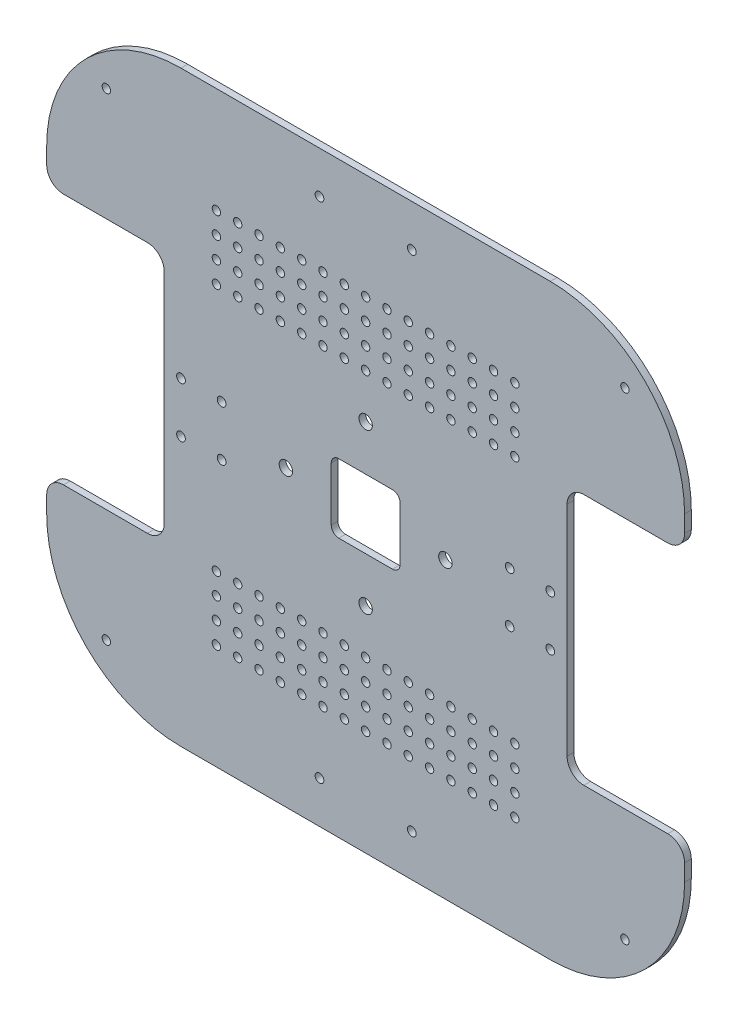
from build123d import *

# Parameters (mm, degrees)
SKETCH_1_R          = 2.6
SKETCH_1_R_2        = 2.5
SKETCH_1_R_3        = 4
SKETCH_1_W          = 41
SKETCH_1_H          = 41
EXTRUDE_1_DEPTH     = 4
FILLET_1_R          = 80
FILLET_2_R          = 10
FILLET_3_R          = 4.5
SKETCH_2_R          = 2.5
CUT_EXTRUDE_1_DEPTH = 10


with BuildPart() as part:
    # 草图1 → 凸台-拉伸1 (new body)
    with BuildSketch(Plane.XY):
        Polygon((-190, 175), (190, 175), (190, 75), (120, 75), (120, -75), (190, -75), (190, -175), (-190, -175), (-190, -75), (-120, -75), (-120, 75), (-190, 75), align=None)
        with Locations((-110, 15)):
            Circle(SKETCH_1_R, mode=Mode.SUBTRACT)
        with Locations((-85.8, 15)):
            Circle(SKETCH_1_R, mode=Mode.SUBTRACT)
        with Locations((-85.8, -15)):
            Circle(SKETCH_1_R, mode=Mode.SUBTRACT)
        with Locations((-110, -15)):
            Circle(SKETCH_1_R, mode=Mode.SUBTRACT)
        with Locations(Location((85.8, -15, 0), (0, 0, 180))):
            Circle(SKETCH_1_R, mode=Mode.SUBTRACT)
        with Locations(Location((110, -15, 0), (0, 0, 180))):
            Circle(SKETCH_1_R, mode=Mode.SUBTRACT)
        with Locations(Location((85.8, 15, 0), (0, 0, 180))):
            Circle(SKETCH_1_R, mode=Mode.SUBTRACT)
        with Locations(Location((110, 15, 0), (0, 0, 180))):
            Circle(SKETCH_1_R, mode=Mode.SUBTRACT)
        with Locations((154.464472083, 142.269908498)):
            Circle(SKETCH_1_R_2, mode=Mode.SUBTRACT)
        with Locations((47.5, 0)):
            Circle(SKETCH_1_R_3, mode=Mode.SUBTRACT)
        with Locations((0, -47.5)):
            Circle(SKETCH_1_R_3, mode=Mode.SUBTRACT)
        with Locations((-154.464472083, 142.269908498)):
            Circle(SKETCH_1_R_2, mode=Mode.SUBTRACT)
        with Locations((-154.464472083, -142.269908498)):
            Circle(SKETCH_1_R_2, mode=Mode.SUBTRACT)
        with Locations((154.464472083, -142.269908498)):
            Circle(SKETCH_1_R_2, mode=Mode.SUBTRACT)
        with Locations((-47.5, 0)):
            Circle(SKETCH_1_R_3, mode=Mode.SUBTRACT)
        with Locations((0, 47.5)):
            Circle(SKETCH_1_R_3, mode=Mode.SUBTRACT)
        with Locations((27.5, -150)):
            Circle(SKETCH_1_R, mode=Mode.SUBTRACT)
        with Locations(Location((-27.5, -150, 0), (0, 0, 180))):
            Circle(SKETCH_1_R, mode=Mode.SUBTRACT)
        with Locations((-27.5, 150)):
            Circle(SKETCH_1_R, mode=Mode.SUBTRACT)
        with Locations(Location((27.5, 150, 0), (0, 0, 180))):
            Circle(SKETCH_1_R, mode=Mode.SUBTRACT)
        Rectangle(SKETCH_1_W, SKETCH_1_H, mode=Mode.SUBTRACT)
    extrude(amount=EXTRUDE_1_DEPTH)

    # 圆角1
    fillet_1_edges = [part.edges().sort_by_distance(p)[0] for p in [
        (190, -175, 2),
        (-190, -175, 2),
        (-190, 175, 2),
        (190, 175, 2),
    ]]
    fillet(fillet_1_edges, radius=FILLET_1_R)

    # 圆角2
    fillet_2_edges = [part.edges().sort_by_distance(p)[0] for p in [
        (-190, -75, 2),
        (-120, -75, 2),
        (-120, 75, 2),
        (-190, 75, 2),
        (190, 75, 2),
        (120, 75, 2),
        (120, -75, 2),
        (190, -75, 2),
    ]]
    fillet(fillet_2_edges, radius=FILLET_2_R)

    # 圆角3
    fillet_3_edges = [part.edges().sort_by_distance(p)[0] for p in [
        (20.5, -20.5, 2),
        (20.5, 20.5, 2),
        (-20.5, 20.5, 2),
        (-20.5, -20.5, 2),
    ]]
    fillet(fillet_3_edges, radius=FILLET_3_R)

    # 草图2 → 切除-拉伸1 (cut)
    with BuildSketch(Plane.XY.offset(4)):
        with Locations((88.9, 74)):
            Circle(SKETCH_2_R)
        with Locations((76.2, 74)):
            Circle(SKETCH_2_R)
        with Locations((63.5, 74)):
            Circle(SKETCH_2_R)
        with Locations((50.8, 74)):
            Circle(SKETCH_2_R)
        with Locations((38.1, 74)):
            Circle(SKETCH_2_R)
        with Locations((25.4, 74)):
            Circle(SKETCH_2_R)
        with Locations((12.7, 74)):
            Circle(SKETCH_2_R)
        with Locations((0, 74)):
            Circle(SKETCH_2_R)
        with Locations((-12.7, 74)):
            Circle(SKETCH_2_R)
        with Locations((-25.4, 74)):
            Circle(SKETCH_2_R)
        with Locations((-38.1, 74)):
            Circle(SKETCH_2_R)
        with Locations((-50.8, 74)):
            Circle(SKETCH_2_R)
        with Locations((-63.5, 74)):
            Circle(SKETCH_2_R)
        with Locations((-76.2, 74)):
            Circle(SKETCH_2_R)
        with Locations((-88.9, 74)):
            Circle(SKETCH_2_R)
        with Locations((76.2, 86.7)):
            Circle(SKETCH_2_R)
        with Locations((63.5, 86.7)):
            Circle(SKETCH_2_R)
        with Locations((50.8, 86.7)):
            Circle(SKETCH_2_R)
        with Locations((38.1, 86.7)):
            Circle(SKETCH_2_R)
        with Locations((25.4, 86.7)):
            Circle(SKETCH_2_R)
        with Locations((12.7, 86.7)):
            Circle(SKETCH_2_R)
        with Locations((0, 86.7)):
            Circle(SKETCH_2_R)
        with Locations((-12.7, 86.7)):
            Circle(SKETCH_2_R)
        with Locations((-25.4, 86.7)):
            Circle(SKETCH_2_R)
        with Locations((-38.1, 86.7)):
            Circle(SKETCH_2_R)
        with Locations((-50.8, 86.7)):
            Circle(SKETCH_2_R)
        with Locations((-63.5, 86.7)):
            Circle(SKETCH_2_R)
        with Locations((-76.2, 86.7)):
            Circle(SKETCH_2_R)
        with Locations((-88.9, 86.7)):
            Circle(SKETCH_2_R)
        with Locations((76.2, 99.4)):
            Circle(SKETCH_2_R)
        with Locations((63.5, 99.4)):
            Circle(SKETCH_2_R)
        with Locations((50.8, 99.4)):
            Circle(SKETCH_2_R)
        with Locations((38.1, 99.4)):
            Circle(SKETCH_2_R)
        with Locations((25.4, 99.4)):
            Circle(SKETCH_2_R)
        with Locations((12.7, 99.4)):
            Circle(SKETCH_2_R)
        with Locations((0, 99.4)):
            Circle(SKETCH_2_R)
        with Locations((-12.7, 99.4)):
            Circle(SKETCH_2_R)
        with Locations((-25.4, 99.4)):
            Circle(SKETCH_2_R)
        with Locations((-38.1, 99.4)):
            Circle(SKETCH_2_R)
        with Locations((-50.8, 99.4)):
            Circle(SKETCH_2_R)
        with Locations((-63.5, 99.4)):
            Circle(SKETCH_2_R)
        with Locations((-76.2, 99.4)):
            Circle(SKETCH_2_R)
        with Locations((-88.9, 99.4)):
            Circle(SKETCH_2_R)
        with Locations((76.2, 112.1)):
            Circle(SKETCH_2_R)
        with Locations((63.5, 112.1)):
            Circle(SKETCH_2_R)
        with Locations((50.8, 112.1)):
            Circle(SKETCH_2_R)
        with Locations((38.1, 112.1)):
            Circle(SKETCH_2_R)
        with Locations((25.4, 112.1)):
            Circle(SKETCH_2_R)
        with Locations((12.7, 112.1)):
            Circle(SKETCH_2_R)
        with Locations((0, 112.1)):
            Circle(SKETCH_2_R)
        with Locations((-12.7, 112.1)):
            Circle(SKETCH_2_R)
        with Locations((-25.4, 112.1)):
            Circle(SKETCH_2_R)
        with Locations((-38.1, 112.1)):
            Circle(SKETCH_2_R)
        with Locations((-50.8, 112.1)):
            Circle(SKETCH_2_R)
        with Locations((-63.5, 112.1)):
            Circle(SKETCH_2_R)
        with Locations((-76.2, 112.1)):
            Circle(SKETCH_2_R)
        with Locations((-88.9, 112.1)):
            Circle(SKETCH_2_R)
        with Locations((88.9, 86.7)):
            Circle(SKETCH_2_R)
        with Locations((88.9, 99.4)):
            Circle(SKETCH_2_R)
        with Locations((88.9, 112.1)):
            Circle(SKETCH_2_R)
        with Locations((88.9, -112.1)):
            Circle(SKETCH_2_R)
        with Locations((88.9, -99.4)):
            Circle(SKETCH_2_R)
        with Locations((88.9, -86.7)):
            Circle(SKETCH_2_R)
        with Locations((-88.9, -112.1)):
            Circle(SKETCH_2_R)
        with Locations((-76.2, -112.1)):
            Circle(SKETCH_2_R)
        with Locations((-63.5, -112.1)):
            Circle(SKETCH_2_R)
        with Locations((-50.8, -112.1)):
            Circle(SKETCH_2_R)
        with Locations((-38.1, -112.1)):
            Circle(SKETCH_2_R)
        with Locations((-25.4, -112.1)):
            Circle(SKETCH_2_R)
        with Locations((-12.7, -112.1)):
            Circle(SKETCH_2_R)
        with Locations((0, -112.1)):
            Circle(SKETCH_2_R)
        with Locations((12.7, -112.1)):
            Circle(SKETCH_2_R)
        with Locations((25.4, -112.1)):
            Circle(SKETCH_2_R)
        with Locations((38.1, -112.1)):
            Circle(SKETCH_2_R)
        with Locations((50.8, -112.1)):
            Circle(SKETCH_2_R)
        with Locations((63.5, -112.1)):
            Circle(SKETCH_2_R)
        with Locations((76.2, -112.1)):
            Circle(SKETCH_2_R)
        with Locations((-88.9, -99.4)):
            Circle(SKETCH_2_R)
        with Locations((-76.2, -99.4)):
            Circle(SKETCH_2_R)
        with Locations((-63.5, -99.4)):
            Circle(SKETCH_2_R)
        with Locations((-50.8, -99.4)):
            Circle(SKETCH_2_R)
        with Locations((-38.1, -99.4)):
            Circle(SKETCH_2_R)
        with Locations((-25.4, -99.4)):
            Circle(SKETCH_2_R)
        with Locations((-12.7, -99.4)):
            Circle(SKETCH_2_R)
        with Locations((0, -99.4)):
            Circle(SKETCH_2_R)
        with Locations((12.7, -99.4)):
            Circle(SKETCH_2_R)
        with Locations((25.4, -99.4)):
            Circle(SKETCH_2_R)
        with Locations((38.1, -99.4)):
            Circle(SKETCH_2_R)
        with Locations((50.8, -99.4)):
            Circle(SKETCH_2_R)
        with Locations((63.5, -99.4)):
            Circle(SKETCH_2_R)
        with Locations((76.2, -99.4)):
            Circle(SKETCH_2_R)
        with Locations((-88.9, -86.7)):
            Circle(SKETCH_2_R)
        with Locations((-76.2, -86.7)):
            Circle(SKETCH_2_R)
        with Locations((-63.5, -86.7)):
            Circle(SKETCH_2_R)
        with Locations((-50.8, -86.7)):
            Circle(SKETCH_2_R)
        with Locations((-38.1, -86.7)):
            Circle(SKETCH_2_R)
        with Locations((-25.4, -86.7)):
            Circle(SKETCH_2_R)
        with Locations((-12.7, -86.7)):
            Circle(SKETCH_2_R)
        with Locations((0, -86.7)):
            Circle(SKETCH_2_R)
        with Locations((12.7, -86.7)):
            Circle(SKETCH_2_R)
        with Locations((25.4, -86.7)):
            Circle(SKETCH_2_R)
        with Locations((38.1, -86.7)):
            Circle(SKETCH_2_R)
        with Locations((50.8, -86.7)):
            Circle(SKETCH_2_R)
        with Locations((63.5, -86.7)):
            Circle(SKETCH_2_R)
        with Locations((76.2, -86.7)):
            Circle(SKETCH_2_R)
        with Locations((-88.9, -74)):
            Circle(SKETCH_2_R)
        with Locations((-76.2, -74)):
            Circle(SKETCH_2_R)
        with Locations((-63.5, -74)):
            Circle(SKETCH_2_R)
        with Locations((-50.8, -74)):
            Circle(SKETCH_2_R)
        with Locations((-38.1, -74)):
            Circle(SKETCH_2_R)
        with Locations((-25.4, -74)):
            Circle(SKETCH_2_R)
        with Locations((-12.7, -74)):
            Circle(SKETCH_2_R)
        with Locations((0, -74)):
            Circle(SKETCH_2_R)
        with Locations((12.7, -74)):
            Circle(SKETCH_2_R)
        with Locations((25.4, -74)):
            Circle(SKETCH_2_R)
        with Locations((38.1, -74)):
            Circle(SKETCH_2_R)
        with Locations((50.8, -74)):
            Circle(SKETCH_2_R)
        with Locations((63.5, -74)):
            Circle(SKETCH_2_R)
        with Locations((76.2, -74)):
            Circle(SKETCH_2_R)
        with Locations((88.9, -74)):
            Circle(SKETCH_2_R)
    extrude(amount=-CUT_EXTRUDE_1_DEPTH, mode=Mode.SUBTRACT)


solid = part.part
